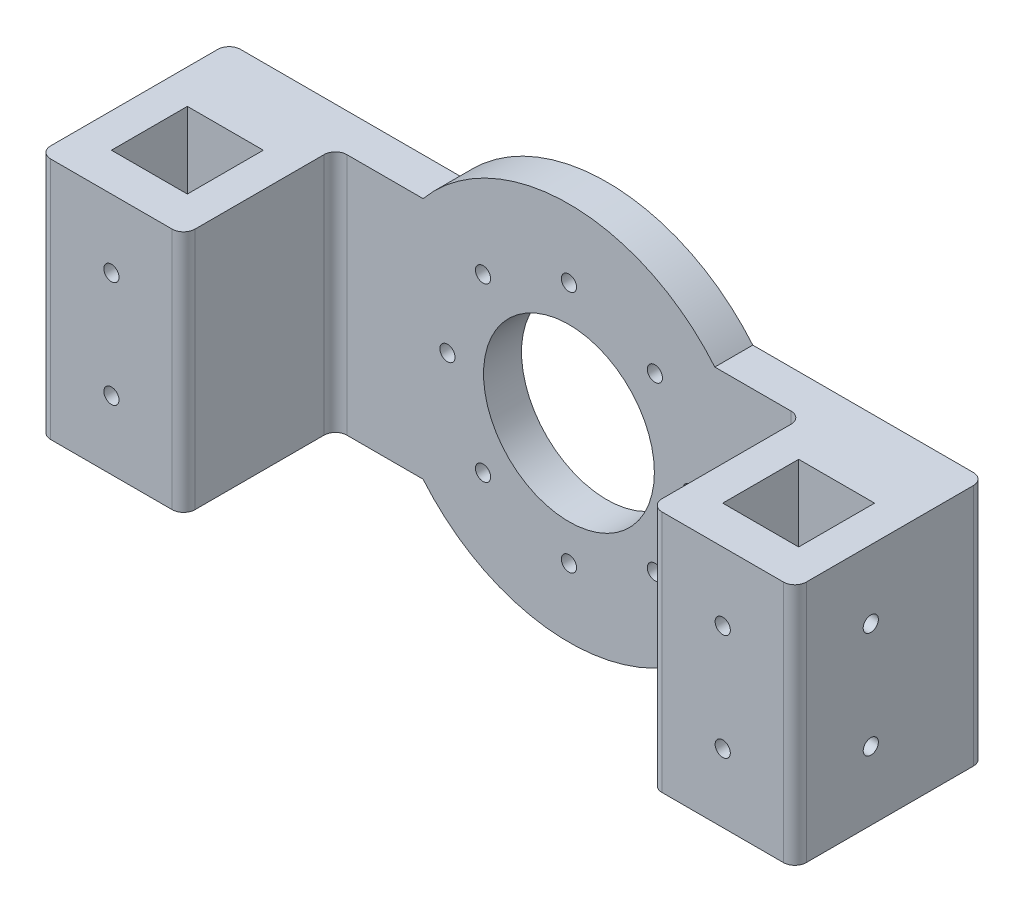
from build123d import *

# Parameters (mm, degrees)
BOSS_EXTRUDE1_DEPTH            = 10
SKETCH2_R                      = 22.5
CUT_EXTRUDE1_DEPTH             = 112.804516903
SKETCH3_R                      = 2
CUT_EXTRUDE2_DEPTH             = 112.804516903
SKETCH5_W                      = 38
SKETCH5_H                      = 64
BOSS_EXTRUDE2_DEPTH            = 40
SKETCH6_W                      = 20
SKETCH6_H                      = 20
CUT_EXTRUDE3_DEPTH             = 139.290455202
CUT_EXTRUDE4_REACH             = 124.067
SKETCH8_R                      = 2
CUT_EXTRUDE4_DIRECTION_2_DEPTH = 123.066580193
CUT_EXTRUDE5_REACH             = 213.189
SKETCH9_R                      = 2
CUT_EXTRUDE6_REACH             = 213.189
SKETCH10_R                     = 2
FILLET1_R                      = 3
FILLET2_R                      = 3
FILLET3_R                      = 3


with BuildPart() as part:
    # Sketch1 → Boss-Extrude1 (new body)
    with BuildSketch(Plane.XY):
        with BuildLine():
            Line((38.418745425, 32), (99.5, 32))
            Line((99.5, 32), (99.5, -32))
            Line((99.5, -32), (38.418745425, -32))
            ThreePointArc((38.418745425, -32), (0, -50), (-38.418745425, -32))
            Line((-38.418745425, -32), (-99.5, -32))
            Line((-99.5, -32), (-99.5, 32))
            Line((-99.5, 32), (-38.418745425, 32))
            ThreePointArc((-38.418745425, 32), (0, 50), (38.418745425, 32))
        make_face()
    extrude(amount=BOSS_EXTRUDE1_DEPTH)

    # Sketch2 → Cut-Extrude1 (cut, through all)
    with BuildSketch(Plane.XY.offset(10)):
        Circle(SKETCH2_R)
    extrude(amount=-CUT_EXTRUDE1_DEPTH, mode=Mode.SUBTRACT)

    # Sketch3 → Cut-Extrude2 (cut, through all)
    with BuildSketch(Plane.XY.offset(10)):
        with Locations((32, 0)):
            Circle(SKETCH3_R)
        with Locations((22.627416998, -22.627416998)):
            Circle(SKETCH3_R)
        with Locations((0, -32)):
            Circle(SKETCH3_R)
        with Locations((-22.627416998, -22.627416998)):
            Circle(SKETCH3_R)
        with Locations((-32, 0)):
            Circle(SKETCH3_R)
        with Locations((-22.627416998, 22.627416998)):
            Circle(SKETCH3_R)
        with Locations((0, 32)):
            Circle(SKETCH3_R)
        with Locations((22.627416998, 22.627416998)):
            Circle(SKETCH3_R)
    extrude(amount=-CUT_EXTRUDE2_DEPTH, mode=Mode.SUBTRACT)

    # Sketch5 → Boss-Extrude2 (add)
    with BuildSketch(Plane.XY.offset(10)):
        with Locations((80.5, 0)):
            Rectangle(SKETCH5_W, SKETCH5_H)
        with Locations((-80.5, 0)):
            Rectangle(SKETCH5_W, SKETCH5_H)
    extrude(amount=BOSS_EXTRUDE2_DEPTH)

    # Sketch6 → Cut-Extrude3 (cut, through all)
    with BuildSketch(Plane(origin=(0, 32, 0), x_dir=(1, 0, 0), z_dir=(0, 1, 0))):
        with Locations((80.5, -30)):
            Rectangle(SKETCH6_W, SKETCH6_H)
        with Locations((-80.5, -30)):
            Rectangle(SKETCH6_W, SKETCH6_H)
    extrude(amount=-CUT_EXTRUDE3_DEPTH, mode=Mode.SUBTRACT)

    # Sketch8 → Cut-Extrude4 (cut, up to next)
    with BuildSketch(Plane.XY.offset(50), mode=Mode.PRIVATE) as cut_extrude4_sk1:
        with Locations(Location((80.5, 14, 0), (0, 0, 180))):
            Circle(SKETCH8_R)
    cut_extrude4_tool1 = extrude(cut_extrude4_sk1.sketch, amount=-CUT_EXTRUDE4_REACH, mode=Mode.PRIVATE) & part.part
    # Sketch8 → Cut-Extrude4 (cut, up to next)
    with BuildSketch(Plane.XY.offset(50), mode=Mode.PRIVATE) as cut_extrude4_sk2:
        with Locations(Location((80.5, -14, 0), (0, 0, 180))):
            Circle(SKETCH8_R)
    cut_extrude4_tool2 = extrude(cut_extrude4_sk2.sketch, amount=-CUT_EXTRUDE4_REACH, mode=Mode.PRIVATE) & part.part
    # Sketch8 → Cut-Extrude4 (cut, up to next)
    with BuildSketch(Plane.XY.offset(50), mode=Mode.PRIVATE) as cut_extrude4_sk3:
        with Locations(Location((-80.5, -14, 0), (0, 0, 180))):
            Circle(SKETCH8_R)
    cut_extrude4_tool3 = extrude(cut_extrude4_sk3.sketch, amount=-CUT_EXTRUDE4_REACH, mode=Mode.PRIVATE) & part.part
    # Sketch8 → Cut-Extrude4 (cut, up to next)
    with BuildSketch(Plane.XY.offset(50), mode=Mode.PRIVATE) as cut_extrude4_sk4:
        with Locations(Location((-80.5, 14, 0), (0, 0, 180))):
            Circle(SKETCH8_R)
    cut_extrude4_tool4 = extrude(cut_extrude4_sk4.sketch, amount=-CUT_EXTRUDE4_REACH, mode=Mode.PRIVATE) & part.part
    add(cut_extrude4_tool1.solids().sort_by_distance((80.5, 14, 50))[0], mode=Mode.SUBTRACT)
    add(cut_extrude4_tool2.solids().sort_by_distance((80.5, -14, 50))[0], mode=Mode.SUBTRACT)
    add(cut_extrude4_tool3.solids().sort_by_distance((-80.5, -14, 50))[0], mode=Mode.SUBTRACT)
    add(cut_extrude4_tool4.solids().sort_by_distance((-80.5, 14, 50))[0], mode=Mode.SUBTRACT)

    # Sketch8 → Cut-Extrude4 direction 2 (cut)
    with BuildSketch(Plane.XY.offset(50)):
        with Locations(Location((80.5, 14, 0), (0, 0, 180))):
            Circle(SKETCH8_R)
        with Locations(Location((80.5, -14, 0), (0, 0, 180))):
            Circle(SKETCH8_R)
        with Locations(Location((-80.5, -14, 0), (0, 0, 180))):
            Circle(SKETCH8_R)
        with Locations(Location((-80.5, 14, 0), (0, 0, 180))):
            Circle(SKETCH8_R)
    extrude(amount=CUT_EXTRUDE4_DIRECTION_2_DEPTH, mode=Mode.SUBTRACT)

    # Sketch9 → Cut-Extrude5 (cut, up to next)
    with BuildSketch(Plane(origin=(99.5, 0, 0), x_dir=(0, 0, -1), z_dir=(1, 0, 0)), mode=Mode.PRIVATE) as cut_extrude5_sk1:
        with Locations((-30, 14)):
            Circle(SKETCH9_R)
    cut_extrude5_tool1 = extrude(cut_extrude5_sk1.sketch, amount=-CUT_EXTRUDE5_REACH, mode=Mode.PRIVATE) & part.part
    # Sketch9 → Cut-Extrude5 (cut, up to next)
    with BuildSketch(Plane(origin=(99.5, 0, 0), x_dir=(0, 0, -1), z_dir=(1, 0, 0)), mode=Mode.PRIVATE) as cut_extrude5_sk2:
        with Locations((-30, -14)):
            Circle(SKETCH9_R)
    cut_extrude5_tool2 = extrude(cut_extrude5_sk2.sketch, amount=-CUT_EXTRUDE5_REACH, mode=Mode.PRIVATE) & part.part
    add(cut_extrude5_tool1.solids().sort_by_distance((99.5, 14, 30))[0], mode=Mode.SUBTRACT)
    add(cut_extrude5_tool2.solids().sort_by_distance((99.5, -14, 30))[0], mode=Mode.SUBTRACT)

    # Sketch10 → Cut-Extrude6 (cut, up to next)
    with BuildSketch(Plane.ZY.offset(99.5), mode=Mode.PRIVATE) as cut_extrude6_sk1:
        with Locations(Location((30, 14, 0), (0, 0, 180))):
            Circle(SKETCH10_R)
    cut_extrude6_tool1 = extrude(cut_extrude6_sk1.sketch, amount=-CUT_EXTRUDE6_REACH, mode=Mode.PRIVATE) & part.part
    # Sketch10 → Cut-Extrude6 (cut, up to next)
    with BuildSketch(Plane.ZY.offset(99.5), mode=Mode.PRIVATE) as cut_extrude6_sk2:
        with Locations(Location((30, -14, 0), (0, 0, 180))):
            Circle(SKETCH10_R)
    cut_extrude6_tool2 = extrude(cut_extrude6_sk2.sketch, amount=-CUT_EXTRUDE6_REACH, mode=Mode.PRIVATE) & part.part
    add(cut_extrude6_tool1.solids().sort_by_distance((-99.5, 14, 30))[0], mode=Mode.SUBTRACT)
    add(cut_extrude6_tool2.solids().sort_by_distance((-99.5, -14, 30))[0], mode=Mode.SUBTRACT)

    # Fillet1
    fillet1_edges = [part.edges().sort_by_distance(p)[0] for p in [
        (61.5, 0, 10),
        (-61.5, 0, 10),
    ]]
    fillet(fillet1_edges, radius=FILLET1_R)

    # Fillet2
    fillet2_edges = [part.edges().sort_by_distance(p)[0] for p in [
        (99.5, 0, 50),
        (61.5, 0, 50),
        (-61.5, 0, 50),
        (-99.5, 0, 50),
    ]]
    fillet(fillet2_edges, radius=FILLET2_R)

    # Fillet3
    fillet3_edges = [part.edges().sort_by_distance(p)[0] for p in [
        (99.5, 0, 0),
        (-99.5, 0, 0),
    ]]
    fillet(fillet3_edges, radius=FILLET3_R)


solid = part.part
